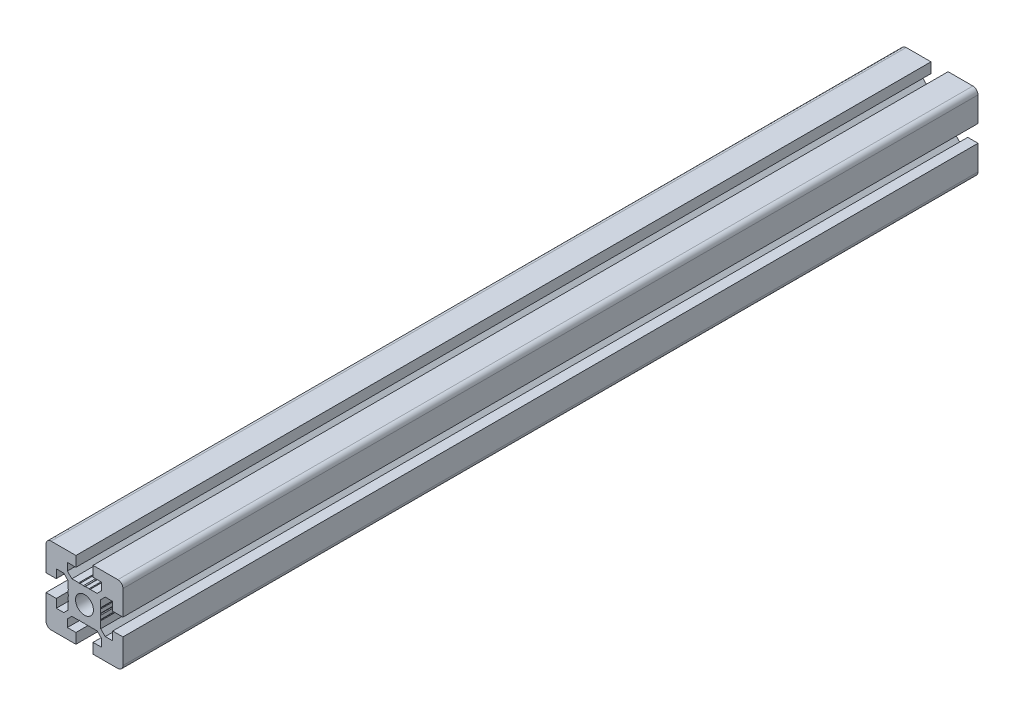
from build123d import *

# Parameters (mm, degrees)
SKETCH1_R           = 5.25
BOSS_EXTRUDE1_DEPTH = 500


with BuildPart() as part:
    # Sketch1 → Boss-Extrude1 (new body)
    with BuildSketch(Plane(origin=(0, 0, -200), x_dir=(-1, 0, 0), z_dir=(0, 0, -1))):
        with BuildLine():
            Line((19.5, 22.5), (5, 22.5))
            Line((5, 22.5), (5, 16.5))
            Line((5, 16.5), (10, 16.5))
            Line((10, 16.5), (10, 12.121320344))
            Line((10, 12.121320344), (7.378679656, 9.5))
            Line((7.378679656, 9.5), (3.346410162, 9.5))
            Line((3.346410162, 9.5), (3, 9.3))
            Line((3, 9.3), (2.653589838, 9.5))
            Line((2.653589838, 9.5), (0.519615242, 9.5))
            Line((0.519615242, 9.5), (0, 9.2))
            Line((0, 9.2), (-0.519615242, 9.5))
            Line((-0.519615242, 9.5), (-2.653589838, 9.5))
            Line((-2.653589838, 9.5), (-3, 9.3))
            Line((-3, 9.3), (-3.346410162, 9.5))
            Line((-3.346410162, 9.5), (-7.378679656, 9.5))
            Line((-7.378679656, 9.5), (-10, 12.121320344))
            Line((-10, 12.121320344), (-10, 16.5))
            Line((-10, 16.5), (-5, 16.5))
            Line((-5, 16.5), (-5, 22.5))
            Line((-5, 22.5), (-19.5, 22.5))
            ThreePointArc((-19.5, 22.5), (-21.621320344, 21.621320344), (-22.5, 19.5))
            Line((-22.5, 19.5), (-22.5, 5))
            Line((-22.5, 5), (-16.5, 5))
            Line((-16.5, 5), (-16.5, 10))
            Line((-16.5, 10), (-12.121320344, 10))
            Line((-12.121320344, 10), (-9.5, 7.378679656))
            Line((-9.5, 7.378679656), (-9.5, 3.346410162))
            Line((-9.5, 3.346410162), (-9.3, 3))
            Line((-9.3, 3), (-9.5, 2.653589838))
            Line((-9.5, 2.653589838), (-9.5, 0.519615242))
            Line((-9.5, 0.519615242), (-9.2, 0))
            Line((-9.2, 0), (-9.5, -0.519615242))
            Line((-9.5, -0.519615242), (-9.5, -2.653589838))
            Line((-9.5, -2.653589838), (-9.3, -3))
            Line((-9.3, -3), (-9.5, -3.346410162))
            Line((-9.5, -3.346410162), (-9.5, -7.378679656))
            Line((-9.5, -7.378679656), (-12.121320344, -10))
            Line((-12.121320344, -10), (-16.5, -10))
            Line((-16.5, -10), (-16.5, -5))
            Line((-16.5, -5), (-22.5, -5))
            Line((-22.5, -5), (-22.5, -19.5))
            ThreePointArc((-22.5, -19.5), (-21.621320344, -21.621320344), (-19.5, -22.5))
            Line((-19.5, -22.5), (-5, -22.5))
            Line((-5, -22.5), (-5, -16.5))
            Line((-5, -16.5), (-10, -16.5))
            Line((-10, -16.5), (-10, -12.121320344))
            Line((-10, -12.121320344), (-7.378679656, -9.5))
            Line((-7.378679656, -9.5), (-3.346410162, -9.5))
            Line((-3.346410162, -9.5), (-3, -9.3))
            Line((-3, -9.3), (-2.653589838, -9.5))
            Line((-2.653589838, -9.5), (-0.519615242, -9.5))
            Line((-0.519615242, -9.5), (0, -9.2))
            Line((0, -9.2), (0.519615242, -9.5))
            Line((0.519615242, -9.5), (2.653589838, -9.5))
            Line((2.653589838, -9.5), (3, -9.3))
            Line((3, -9.3), (3.346410162, -9.5))
            Line((3.346410162, -9.5), (7.378679656, -9.5))
            Line((7.378679656, -9.5), (10, -12.121320344))
            Line((10, -12.121320344), (10, -16.5))
            Line((10, -16.5), (5, -16.5))
            Line((5, -16.5), (5, -22.5))
            Line((5, -22.5), (19.5, -22.5))
            ThreePointArc((19.5, -22.5), (21.621320344, -21.621320344), (22.5, -19.5))
            Line((22.5, -19.5), (22.5, -5))
            Line((22.5, -5), (16.5, -5))
            Line((16.5, -5), (16.5, -10))
            Line((16.5, -10), (12.121320344, -10))
            Line((12.121320344, -10), (9.5, -7.378679656))
            Line((9.5, -7.378679656), (9.5, -3.346410162))
            Line((9.5, -3.346410162), (9.3, -3))
            Line((9.3, -3), (9.5, -2.653589838))
            Line((9.5, -2.653589838), (9.5, -0.519615242))
            Line((9.5, -0.519615242), (9.2, 0))
            Line((9.2, 0), (9.5, 0.519615242))
            Line((9.5, 0.519615242), (9.5, 2.653589838))
            Line((9.5, 2.653589838), (9.3, 3))
            Line((9.3, 3), (9.5, 3.346410162))
            Line((9.5, 3.346410162), (9.5, 7.378679656))
            Line((9.5, 7.378679656), (12.121320344, 10))
            Line((12.121320344, 10), (16.5, 10))
            Line((16.5, 10), (16.5, 5))
            Line((16.5, 5), (22.5, 5))
            Line((22.5, 5), (22.5, 19.5))
            ThreePointArc((22.5, 19.5), (21.621320344, 21.621320344), (19.5, 22.5))
        make_face()
        with Locations(Location((0, 0, 0), (0, 0, 180))):
            Circle(SKETCH1_R, mode=Mode.SUBTRACT)
    extrude(amount=-BOSS_EXTRUDE1_DEPTH)


solid = part.part
